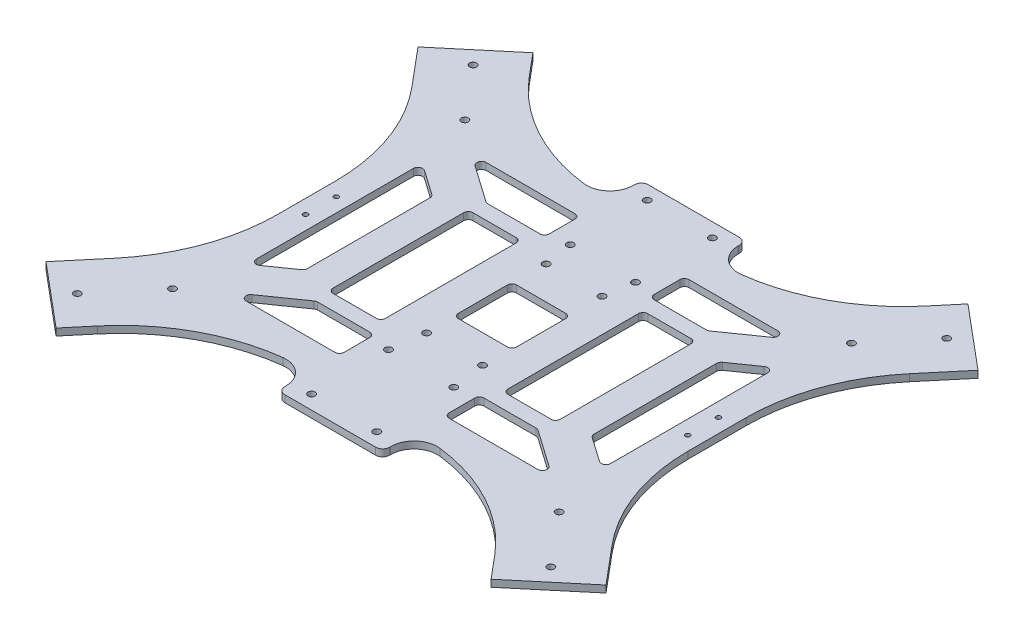
from build123d import *

# Parameters (mm, degrees)
BOSS_EXTRUDE1_DEPTH = 3
FILLET1_R           = 80
SKETCH3_W           = 45
SKETCH3_H           = 28
BOSS_EXTRUDE2_DEPTH = 3
FILLET2_R           = 10
FILLET3_R           = 3
SKETCH4_R           = 1.5
CUT_EXTRUDE1_DEPTH  = 10
SKETCH7_R           = 1.5
CUT_EXTRUDE2_DEPTH  = 10
SKETCH10_W          = 22.5
SKETCH10_H          = 60
CUT_EXTRUDE5_DEPTH  = 4.5
FILLET4_R           = 2
SKETCH11_R          = 1
CUT_EXTRUDE6_DEPTH  = 10
SKETCH12_R          = 1.51
SKETCH12_R_2        = 1.5
SKETCH12_R_3        = 1.498824556
CUT_EXTRUDE7_DEPTH  = 10


with BuildPart() as part:
    # Sketch1 → Boss-Extrude1 (new body)
    with BuildSketch(Plane(origin=(0, 0, 0), x_dir=(1, 0, 0), z_dir=(0, 1, 0))):
        Polygon((-120.139380484, 79.804655817), (-88, 41.502433661), (-88, -41.502433661), (-120.139380484, -79.804655817), (-93.327824975, -102.302222156), (-61.188444491, -64), (61.188444491, -64), (93.327824975, -102.302222156), (120.139380484, -79.804655817), (88, -41.502433661), (88, 41.502433661), (120.139380484, 79.804655817), (93.327824975, 102.302222156), (61.188444491, 64), (-61.188444491, 64), (-93.327824975, 102.302222156), align=None)
    extrude(amount=BOSS_EXTRUDE1_DEPTH)

    # Fillet1
    fillet1_edges = [part.edges().sort_by_distance(p)[0] for p in [
        (-88, 1.5, 41.502433661),
        (-61.188444491, 1.5, 64),
        (61.188444491, 1.5, 64),
        (88, 1.5, 41.502433661),
        (88, 1.5, -41.502433661),
        (61.188444491, 1.5, -64),
        (-61.188444491, 1.5, -64),
        (-88, 1.5, -41.502433661),
    ]]
    fillet(fillet1_edges, radius=FILLET1_R)

    # Sketch3 → Boss-Extrude2 (add)
    with BuildSketch(Plane(origin=(0, 3, 0), x_dir=(1, 0, 0), z_dir=(0, 1, 0))):
        with Locations((0, 64)):
            Rectangle(SKETCH3_W, SKETCH3_H)
        with Locations((0, -64)):
            Rectangle(SKETCH3_W, SKETCH3_H)
    extrude(amount=-BOSS_EXTRUDE2_DEPTH)

    # Fillet2
    fillet2_edges = [part.edges().sort_by_distance(p)[0] for p in [
        (-22.5, 1.5, -64),
        (22.5, 1.5, -64),
        (22.5, 1.5, 64),
        (-22.5, 1.5, 64),
    ]]
    fillet(fillet2_edges, radius=FILLET2_R)

    # Fillet3
    fillet3_edges = [part.edges().sort_by_distance(p)[0] for p in [
        (22.5, 1.5, 78),
        (-22.5, 1.5, 78),
        (22.5, 1.5, -78),
        (-22.5, 1.5, -78),
    ]]
    fillet(fillet3_edges, radius=FILLET3_R)

    # Sketch4 → Cut-Extrude1 (cut)
    with BuildSketch(Plane.XZ):
        with Locations((-101.591301852, 84.925083441)):
            Circle(SKETCH4_R)
        with Locations((-82.950461171, 62.709794591)):
            Circle(SKETCH4_R)
        with Locations((101.591301852, 84.925083441)):
            Circle(SKETCH4_R)
        with Locations((82.950461171, 62.709794591)):
            Circle(SKETCH4_R)
        with Locations((101.591301852, -84.925083441)):
            Circle(SKETCH4_R)
        with Locations((82.950461171, -62.709794591)):
            Circle(SKETCH4_R)
        with Locations((-101.591301852, -84.925083441)):
            Circle(SKETCH4_R)
        with Locations((-82.950461171, -62.709794591)):
            Circle(SKETCH4_R)
    extrude(amount=-CUT_EXTRUDE1_DEPTH, mode=Mode.SUBTRACT)

    # Sketch7 → Cut-Extrude2 (cut)
    with BuildSketch(Plane(origin=(0, 3, 0), x_dir=(1, 0, 0), z_dir=(0, 1, 0))):
        with Locations((-14, 72)):
            Circle(SKETCH7_R)
        with Locations((14, 72)):
            Circle(SKETCH7_R)
        with Locations((14, 39)):
            Circle(SKETCH7_R)
        with Locations((-14, 39)):
            Circle(SKETCH7_R)
    cut_extrude2 = extrude(amount=-CUT_EXTRUDE2_DEPTH, mode=Mode.SUBTRACT)

    # Mirror1: Cut-Extrude2 across plane
    add(cut_extrude2.mirror(Plane(origin=(0, 0, 0), x_dir=(1, 0, 0), z_dir=(0, 0, -1))), mode=Mode.SUBTRACT)

    # Sketch10 → Cut-Extrude5 (cut)
    with BuildSketch(Plane(origin=(0, 3, 0), x_dir=(1, 0, 0), z_dir=(0, 1, 0))):
        Polygon((-61.5, -27.35), (-61.5, 27.35), (-75.995702268, 37.5), (-75.995702268, -37.5), align=None)
        with Locations((-37.5, 0)):
            Rectangle(SKETCH10_W, SKETCH10_H)
        Polygon((12.5, 12.5), (0, 12.5), (-12.5, 12.5), (-12.5, -12.5), (12.5, -12.5), align=None)
        Polygon((-22.5, 36.5), (-22.5, 51.5), (-68.922220101, 51.5), (-47.5, 36.5), align=None)
        Polygon((47.5, 36.5), (68.922220101, 51.5), (22.5, 51.5), (22.5, 36.5), align=None)
        Polygon((22.5, -36.5), (22.5, -51.5), (68.922220101, -51.5), (47.5, -36.5), align=None)
        Polygon((-47.5, -36.5), (-68.922220101, -51.5), (-22.5, -51.5), (-22.5, -36.5), align=None)
        Polygon((61.5, 27.35), (61.5, -27.35), (75.995702268, -37.5), (75.995702268, 37.5), align=None)
        with Locations((37.5, 0)):
            Rectangle(SKETCH10_W, SKETCH10_H)
    extrude(amount=-CUT_EXTRUDE5_DEPTH, mode=Mode.SUBTRACT)

    # Fillet4
    fillet4_edges = [part.edges().sort_by_distance(p)[0] for p in [
        (12.5, 1.5, 12.5),
        (-12.5, 1.5, 12.5),
        (12.5, 1.5, -12.5),
        (-12.5, 1.5, -12.5),
        (68.922220101, 1.5, -51.5),
        (22.5, 1.5, -51.5),
        (22.5, 1.5, -36.5),
        (47.5, 1.5, -36.5),
        (75.995702268, 1.5, -37.5),
        (61.5, 1.5, -27.35),
        (61.5, 1.5, 27.35),
        (75.995702268, 1.5, 37.5),
        (68.922220101, 1.5, 51.5),
        (47.5, 1.5, 36.5),
        (22.5, 1.5, 36.5),
        (22.5, 1.5, 51.5),
        (-22.5, 1.5, 51.5),
        (-22.5, 1.5, 36.5),
        (-68.922220101, 1.5, 51.5),
        (-47.5, 1.5, 36.5),
        (-61.5, 1.5, 27.35),
        (-75.995702268, 1.5, 37.5),
        (-22.5, 1.5, -36.5),
        (-47.5, 1.5, -36.5),
        (-68.922220101, 1.5, -51.5),
        (-22.5, 1.5, -51.5),
        (-61.5, 1.5, -27.35),
        (-75.995702268, 1.5, -37.5),
        (48.75, 1.5, -30),
        (26.25, 1.5, -30),
        (48.75, 1.5, 30),
        (26.25, 1.5, 30),
        (-26.25, 1.5, 30),
        (-48.75, 1.5, 30),
        (-26.25, 1.5, -30),
        (-48.75, 1.5, -30),
    ]]
    fillet(fillet4_edges, radius=FILLET4_R)

    # Sketch11 → Cut-Extrude6 (cut)
    with BuildSketch(Plane(origin=(0, 3, 0), x_dir=(1, 0, 0), z_dir=(0, 1, 0))):
        with Locations((82, 6.6)):
            Circle(SKETCH11_R)
        with Locations((82, -6.6)):
            Circle(SKETCH11_R)
    cut_extrude6 = extrude(amount=-CUT_EXTRUDE6_DEPTH, mode=Mode.SUBTRACT)

    # Mirror2: Cut-Extrude6 across plane
    add(cut_extrude6.mirror(Plane(origin=(0, 0, 0), x_dir=(0, 0, 1), z_dir=(1, 0, 0))), mode=Mode.SUBTRACT)

    # Sketch12 → Cut-Extrude7 (cut)
    with BuildSketch(Plane.XZ):
        with Locations((-12, 24.65)):
            Circle(SKETCH12_R)
        with Locations((12, 24.65)):
            Circle(SKETCH12_R_2)
        with Locations((-12, -26.65)):
            Circle(SKETCH12_R_2)
        with Locations((12, -26.65)):
            Circle(SKETCH12_R_3)
    extrude(amount=-CUT_EXTRUDE7_DEPTH, mode=Mode.SUBTRACT)


solid = part.part
